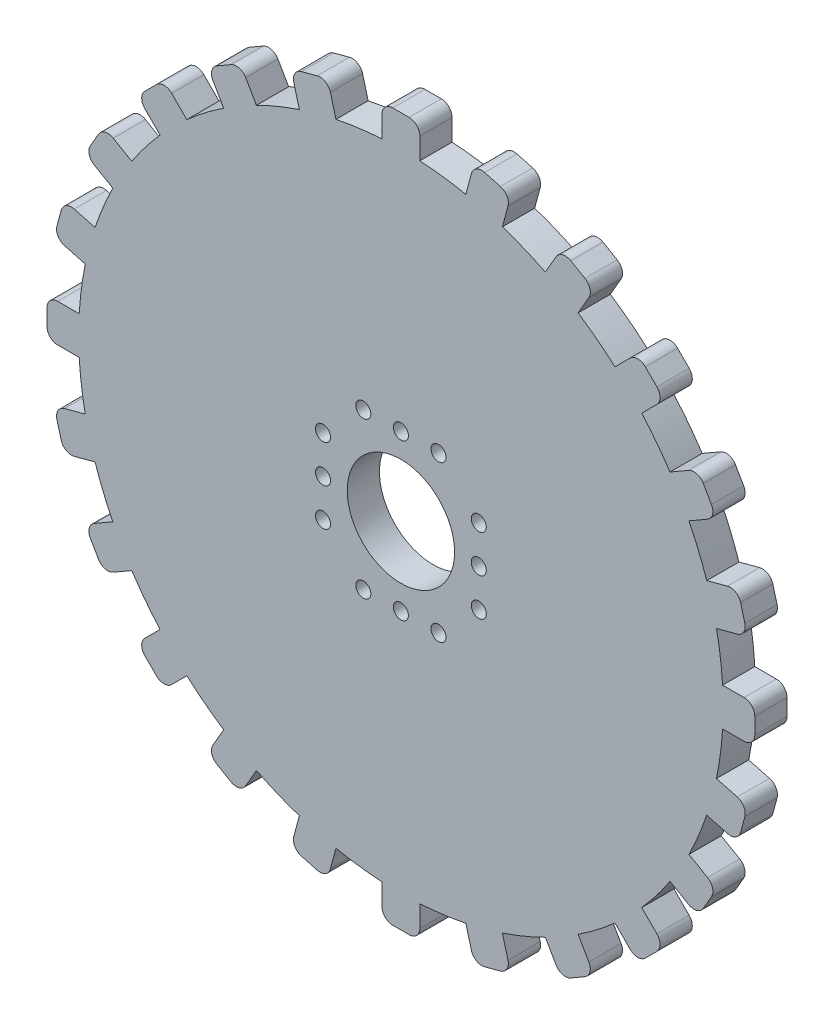
from build123d import *

# Parameters (mm, degrees)
SKETCH1_R           = 30
SKETCH1_R_2         = 5
SKETCH1_R_3         = 0.7
BOSS_EXTRUDE1_DEPTH = 3
BOSS_EXTRUDE2_DEPTH = 3
CIRPATTERN2_COUNT   = 24


with BuildPart() as part:
    # Sketch1 → Boss-Extrude1 (new body)
    with BuildSketch(Plane.XY):
        Circle(SKETCH1_R)
        Circle(SKETCH1_R_2, mode=Mode.SUBTRACT)
        with Locations((-3.5, 7.25)):
            Circle(SKETCH1_R_3, mode=Mode.SUBTRACT)
        with Locations((0, 7.25)):
            Circle(SKETCH1_R_3, mode=Mode.SUBTRACT)
        with Locations((3.5, 7.25)):
            Circle(SKETCH1_R_3, mode=Mode.SUBTRACT)
        with Locations((7.25, 3.5)):
            Circle(SKETCH1_R_3, mode=Mode.SUBTRACT)
        with Locations((7.25, 0)):
            Circle(SKETCH1_R_3, mode=Mode.SUBTRACT)
        with Locations((7.25, -3.5)):
            Circle(SKETCH1_R_3, mode=Mode.SUBTRACT)
        with Locations((3.5, -7.25)):
            Circle(SKETCH1_R_3, mode=Mode.SUBTRACT)
        with Locations((0, -7.25)):
            Circle(SKETCH1_R_3, mode=Mode.SUBTRACT)
        with Locations((-3.5, -7.25)):
            Circle(SKETCH1_R_3, mode=Mode.SUBTRACT)
        with Locations((-7.25, -3.5)):
            Circle(SKETCH1_R_3, mode=Mode.SUBTRACT)
        with Locations((-7.25, 0)):
            Circle(SKETCH1_R_3, mode=Mode.SUBTRACT)
        with Locations((-7.25, 3.5)):
            Circle(SKETCH1_R_3, mode=Mode.SUBTRACT)
    extrude(amount=BOSS_EXTRUDE1_DEPTH)

    # Sketch2 → Boss-Extrude2 (add)
    with BuildSketch(Plane.XY.offset(3)):
        with BuildLine():
            Line((29.948176492, 1.762590363), (31.948176492, 1.762590363))
            ThreePointArc((31.948176492, 1.762590363), (32.655283273, 1.469697144), (32.948176492, 0.762590363))
            Line((32.948176492, 0.762590363), (32.948176492, -0.762590363))
            ThreePointArc((32.948176492, -0.762590363), (32.655283273, -1.469697144), (31.948176492, -1.762590363))
            Line((31.948176492, -1.762590363), (29.948176492, -1.762590363))
            Line((29.948176492, -1.762590363), (29.948176492, 1.762590363))
        make_face()
    boss_extrude2 = extrude(amount=-BOSS_EXTRUDE2_DEPTH)

    # CirPattern2: Boss-Extrude2 ×24 about axis
    cirpattern2_axis = Axis((0, 0, 0), (0, 0, 1))
    for i in range(1, CIRPATTERN2_COUNT):
        add(boss_extrude2.rotate(cirpattern2_axis, i * 360 / CIRPATTERN2_COUNT))


solid = part.part
